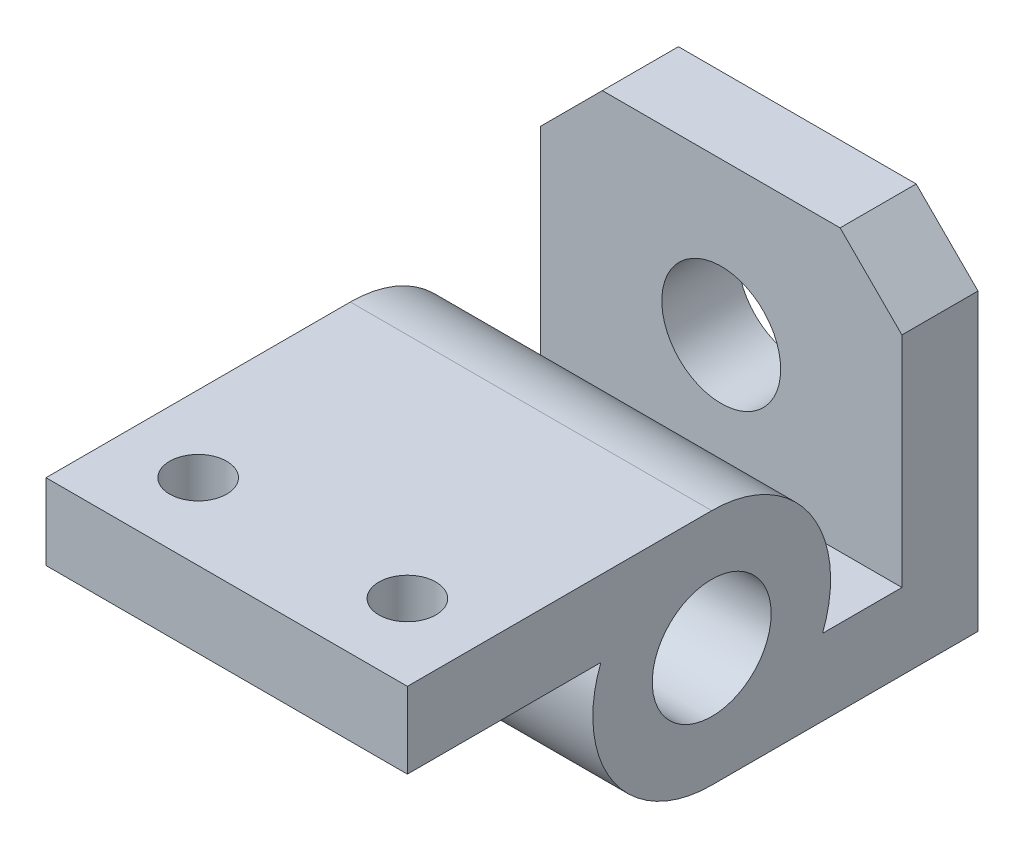
from build123d import *

# Parameters (mm, degrees)
BOSS_EXTRUDE1_DEPTH     = 38
CUT_EXTRUDE1_DEPTH      = 90.666047086
CUT_EXTRUDE1_DEPTH_BACK = 90.666047086
SKETCH1_3_R             = 12.5
CHAMFER1_SIZE           = 13
SKETCH3_R               = 12.5
CUT_EXTRUDE3_DEPTH      = 76
SKETCH4_R               = 6
CUT_EXTRUDE4_DEPTH      = 90.666047086


with BuildPart() as part:
    # Sketch1 → Boss-Extrude1 (new, symmetric)
    with BuildSketch(Plane(origin=(0, 0, 0), x_dir=(0, 0, -1), z_dir=(1, 0, 0))):
        with BuildLine():
            Line((0, -25), (56, -25))
            Line((56, -25), (56, 50))
            Line((56, 50), (40, 50))
            Line((40, 50), (40, -9))
            Line((40, -9), (23.323807579, -9))
            ThreePointArc((23.323807579, -9), (20.615528128, 14.142135624), (0, 25))
            Line((0, 25), (-64, 25))
            Line((-64, 25), (-64, 9))
            Line((-64, 9), (-23.323807579, 9))
            ThreePointArc((-23.323807579, 9), (-20.615528128, -14.142135624), (0, -25))
        make_face()
    extrude(amount=BOSS_EXTRUDE1_DEPTH, both=True)

    # Sketch1<3> → Cut-Extrude1 (cut, two sides: drawn at the far end of the back side and taken through both)
    with BuildSketch(Plane(origin=(0, 0, 0), x_dir=(0, 0, -1), z_dir=(1, 0, 0)).offset(-CUT_EXTRUDE1_DEPTH_BACK)):
        Circle(SKETCH1_3_R)
    extrude(amount=CUT_EXTRUDE1_DEPTH + CUT_EXTRUDE1_DEPTH_BACK, mode=Mode.SUBTRACT)

    # Chamfer1
    chamfer1_edges = [part.edges().sort_by_distance(p)[0] for p in [
        (-38, 50, -48),
        (38, 50, -48),
    ]]
    chamfer(chamfer1_edges, length=CHAMFER1_SIZE)

    # Sketch3 → Cut-Extrude3 (cut)
    with BuildSketch(Plane.XY.offset(-40)):
        with Locations((0, 18)):
            Circle(SKETCH3_R)
    extrude(amount=-CUT_EXTRUDE3_DEPTH, mode=Mode.SUBTRACT)

    # Sketch4 → Cut-Extrude4 (cut, through all)
    with BuildSketch(Plane(origin=(0, 25, 0), x_dir=(1, 0, 0), z_dir=(0, 1, 0))):
        with Locations((-22, -48)):
            Circle(SKETCH4_R)
        with Locations((22, -48)):
            Circle(SKETCH4_R)
    extrude(amount=-CUT_EXTRUDE4_DEPTH, mode=Mode.SUBTRACT)


solid = part.part
